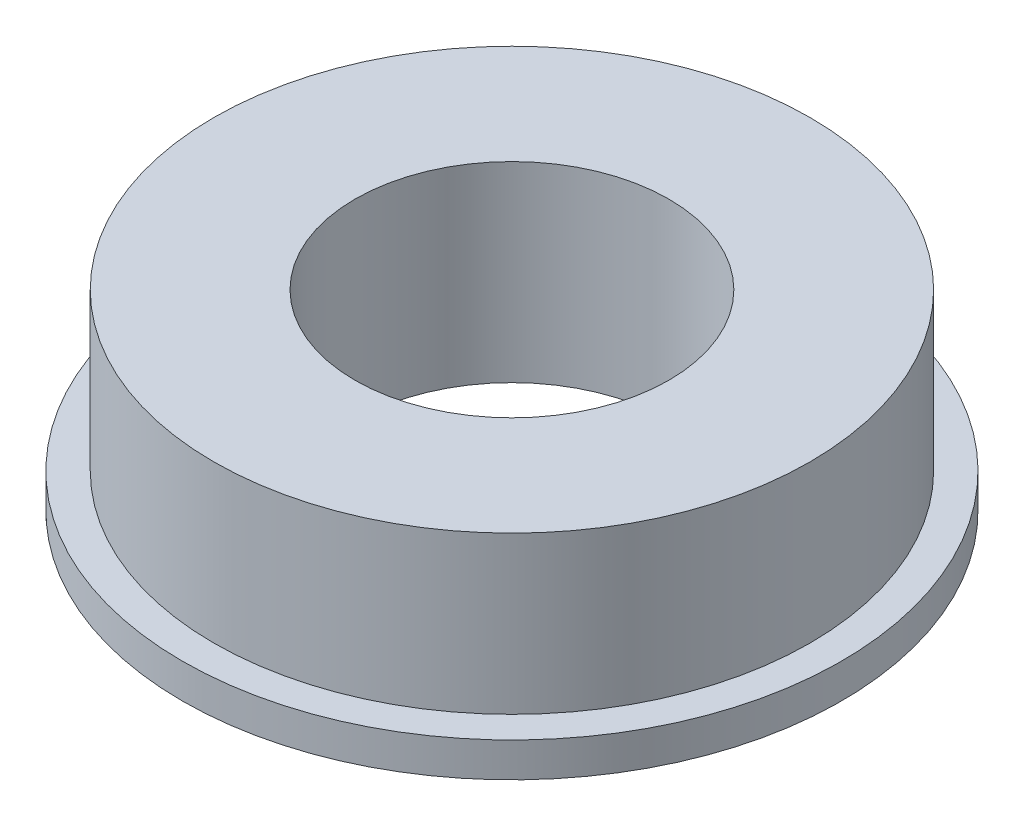
from build123d import *

# Parameters (mm, degrees)
SKETCH_1_R      = 10.5
SKETCH_1_R_2    = 5
EXTRUDE_1_DEPTH = 1.1
SKETCH_2_R      = 9.5
SKETCH_2_R_2    = 5
EXTRUDE_2_DEPTH = 5


with BuildPart() as part:
    # 草图1 → 凸台-拉伸1 (new body)
    with BuildSketch(Plane(origin=(0, 0, 0), x_dir=(1, 0, 0), z_dir=(0, 1, 0))):
        with Locations(Location((0, 0, 0), (0, 0, 270))):
            Circle(SKETCH_1_R)
        with Locations(Location((0, 0, 0), (0, 0, 270))):
            Circle(SKETCH_1_R_2, mode=Mode.SUBTRACT)
    extrude(amount=EXTRUDE_1_DEPTH)

    # 草图2 → 凸台-拉伸2 (add)
    with BuildSketch(Plane(origin=(0, 1.1, 0), x_dir=(1, 0, 0), z_dir=(0, 1, 0))):
        with Locations(Location((0, 0, 0), (0, 0, 270))):
            Circle(SKETCH_2_R)
        with Locations(Location((0, 0, 0), (0, 0, 270))):
            Circle(SKETCH_2_R_2, mode=Mode.SUBTRACT)
    extrude(amount=EXTRUDE_2_DEPTH)


solid = part.part
